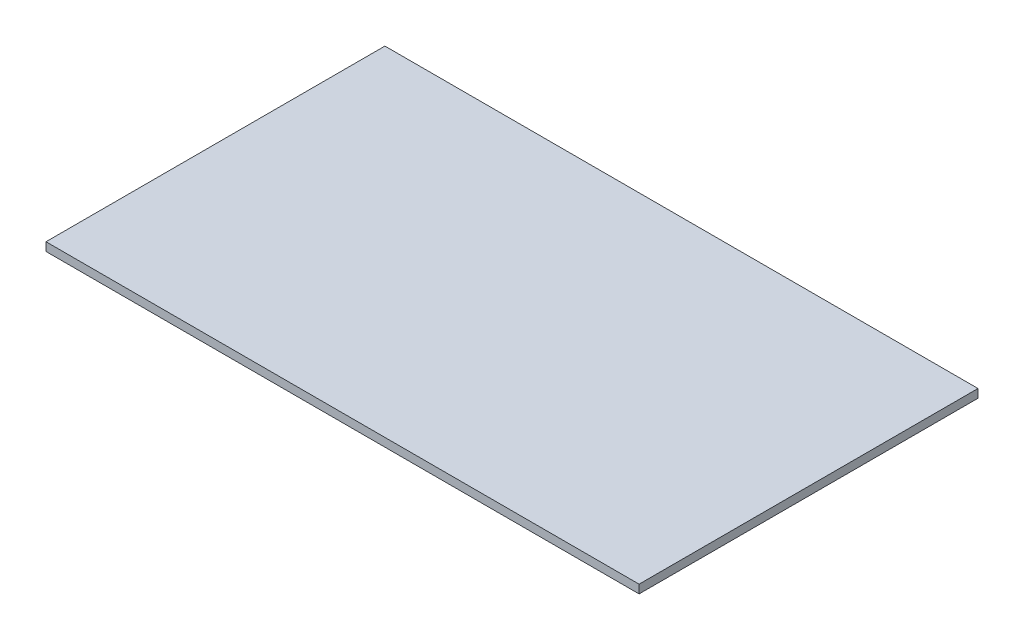
from build123d import *

# Parameters (mm, degrees)
ESQUISSE1_W        = 350
ESQUISSE1_H        = 200
BOSS_EXTRU_1_DEPTH = 5


with BuildPart() as part:
    # Esquisse1 → Boss.-Extru.1 (new body)
    with BuildSketch(Plane(origin=(0, 0, 0), x_dir=(1, 0, 0), z_dir=(0, 1, 0))):
        Rectangle(ESQUISSE1_W, ESQUISSE1_H)
    extrude(amount=BOSS_EXTRU_1_DEPTH)


solid = part.part
